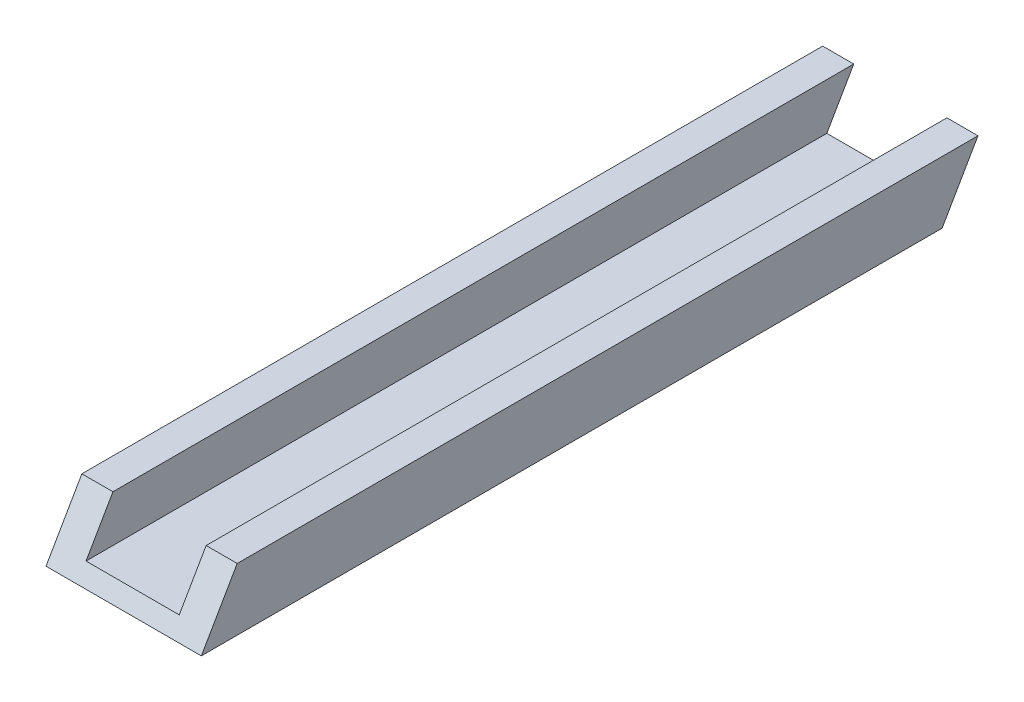
from build123d import *

# Parameters (mm, degrees)
SKETCH2_W               = 50
SKETCH2_H               = 250
BOSS_EXTRUDE1_DEPTH     = 20
CUT_EXTRUDE1_DEPTH      = 256.734237051
CUT_EXTRUDE1_DEPTH_BACK = 256.734237051
SKETCH3_OUTSIDE_W       = 303.146
SKETCH3_OUTSIDE_H       = 73.146
CUT_EXTRUDE2_START      = -10
CUT_EXTRUDE2_DEPTH      = 30


with BuildPart() as part:
    # Sketch2 → Boss-Extrude1 (new body)
    with BuildSketch(Plane(origin=(0, 0, 0), x_dir=(1, 0, 0), z_dir=(0, 1, 0))):
        with Locations((25, 125)):
            Rectangle(SKETCH2_W, SKETCH2_H)
    extrude(amount=BOSS_EXTRUDE1_DEPTH)

    # Sketch3 outside → Cut-Extrude1 (cut, two sides: drawn at the far end of the back side and taken through both)
    with BuildSketch(Plane(origin=(50, 0, 0), x_dir=(0, 0, -1), z_dir=(1, 0, 0)).offset(-CUT_EXTRUDE1_DEPTH_BACK)):
        with Locations((125, 10)):
            Rectangle(SKETCH3_OUTSIDE_W, SKETCH3_OUTSIDE_H)
        Polygon((0, 0), (11.547005384, 20), (250, 20), (238.452994616, 0), align=None, mode=Mode.SUBTRACT)
    extrude(amount=CUT_EXTRUDE1_DEPTH + CUT_EXTRUDE1_DEPTH_BACK, mode=Mode.SUBTRACT)

    # Sketch4 → Cut-Extrude2 (cut)
    with BuildSketch(Plane(origin=(50, 0, 0), x_dir=(0, 0, -1), z_dir=(1, 0, 0)).offset(CUT_EXTRUDE2_START)):
        Polygon((11.547005384, 20), (250, 20), (241.339745962, 5), (2.886751346, 5), align=None)
    extrude(amount=-CUT_EXTRUDE2_DEPTH, mode=Mode.SUBTRACT)


solid = part.part
